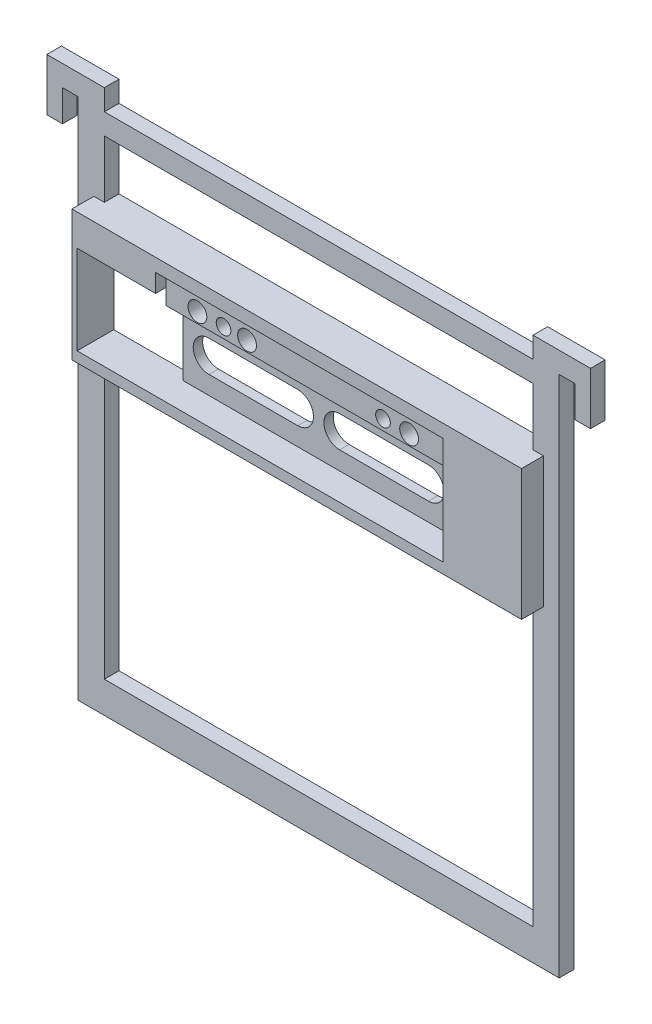
from build123d import *

# Parameters (mm, degrees)
SKETCH_1_W          = 86
SKETCH_1_H          = 25
EXTRUDE_1_DEPTH     = 7
SKETCH_2_W          = 15
SKETCH_2_H          = 17
CUT_EXTRUDE_1_DEPTH = 90.833178726
SKETCH_3_W          = 55
SKETCH_3_H          = 13
CUT_EXTRUDE_2_DEPTH = 5.2
SKETCH_4_W          = 55
SKETCH_4_H          = 7.5
CUT_EXTRUDE_3_DEPTH = 2
SKETCH_5_R          = 1.8
CUT_EXTRUDE_4_DEPTH = 90.699498326
SKETCH_6_R          = 1.4
CUT_EXTRUDE_5_DEPTH = 90.699498326
CUT_EXTRUDE_6_DEPTH = 90.710868907
CHAMFER_1_SIZE      = 1
SKETCH_9_W          = 82
SKETCH_9_H          = 52
EXTRUDE_2_DEPTH     = 2.8


with BuildPart() as part:
    # 草图1 → 凸台-拉伸1 (new body)
    with BuildSketch(Plane.XY):
        with Locations((43, 12.5)):
            Rectangle(SKETCH_1_W, SKETCH_1_H)
    extrude(amount=EXTRUDE_1_DEPTH)

    # 草图2 → 切除-拉伸1 (cut, through all)
    with BuildSketch(Plane.XY.offset(7)):
        with Locations((8.5, 10.5)):
            Rectangle(SKETCH_2_W, SKETCH_2_H)
    extrude(amount=-CUT_EXTRUDE_1_DEPTH, mode=Mode.SUBTRACT)

    # 草图3 → 切除-拉伸2 (cut)
    with BuildSketch(Plane.XY.offset(7)):
        with Locations((43.5, 8.5)):
            Rectangle(SKETCH_3_W, SKETCH_3_H)
    extrude(amount=-CUT_EXTRUDE_2_DEPTH, mode=Mode.SUBTRACT)

    # 草图4 → 切除-拉伸3 (cut)
    with BuildSketch(Plane.XY.offset(7)):
        with Locations((43.5, 18.75)):
            Rectangle(SKETCH_4_W, SKETCH_4_H)
    extrude(amount=-CUT_EXTRUDE_3_DEPTH, mode=Mode.SUBTRACT)

    # 草图5 → 切除-拉伸4 (cut, through all)
    with BuildSketch(Plane.XY.offset(5)):
        with Locations((22, 18)):
            Circle(SKETCH_5_R)
        with Locations((31.5, 18)):
            Circle(SKETCH_5_R)
        with Locations((62.5, 18)):
            Circle(SKETCH_5_R)
    extrude(amount=-CUT_EXTRUDE_4_DEPTH, mode=Mode.SUBTRACT)

    # 草图6 → 切除-拉伸5 (cut, through all)
    with BuildSketch(Plane.XY.offset(5)):
        with Locations((27, 18)):
            Circle(SKETCH_6_R)
        with Locations((57.5, 18)):
            Circle(SKETCH_6_R)
    extrude(amount=-CUT_EXTRUDE_5_DEPTH, mode=Mode.SUBTRACT)

    # 草图7 → 切除-拉伸6 (cut, through all)
    with BuildSketch(Plane.XY.offset(1.8)):
        with BuildLine():
            Line((21, 11.5), (38, 11.5))
            ThreePointArc((38, 11.5), (41, 8.5), (38, 5.5))
            Line((38, 5.5), (21, 5.5))
            ThreePointArc((21, 5.5), (18, 8.5), (21, 11.5))
        make_face()
        with BuildLine():
            Line((46, 11.5), (63, 11.5))
            ThreePointArc((63, 11.5), (66, 8.5), (63, 5.5))
            Line((63, 5.5), (46, 5.5))
            ThreePointArc((46, 5.5), (43, 8.5), (46, 11.5))
        make_face()
    extrude(amount=-CUT_EXTRUDE_6_DEPTH, mode=Mode.SUBTRACT)

    # 倒角1
    chamfer_1_edges = [part.edges().sort_by_distance(p)[0] for p in [
        (43.5, 15, 5),
    ]]
    chamfer(chamfer_1_edges, length=CHAMFER_1_SIZE)

    # 草图9 → 凸台-拉伸2 (add)
    with BuildSketch(Plane(origin=(0, 0, 0), x_dir=(-1, 0, 0), z_dir=(0, 0, -1))):
        Polygon((-95, 34), (-92, 34), (-92, 40), (-89, 40), (-89, -60), (3, -60), (3, 40), (6, 40), (6, 34), (9, 34), (9, 44), (-2, 44), (-2, 40), (-84, 40), (-84, 44), (-95, 44), align=None)
        Polygon((-86, 0), (0, 0), (0, 25), (-2, 25), (-2, 36), (-84, 36), (-84, 25), (-86, 25), align=None, mode=Mode.SUBTRACT)
        with Locations((-43, -28)):
            Rectangle(SKETCH_9_W, SKETCH_9_H, mode=Mode.SUBTRACT)
    extrude(amount=-EXTRUDE_2_DEPTH)


solid = part.part
